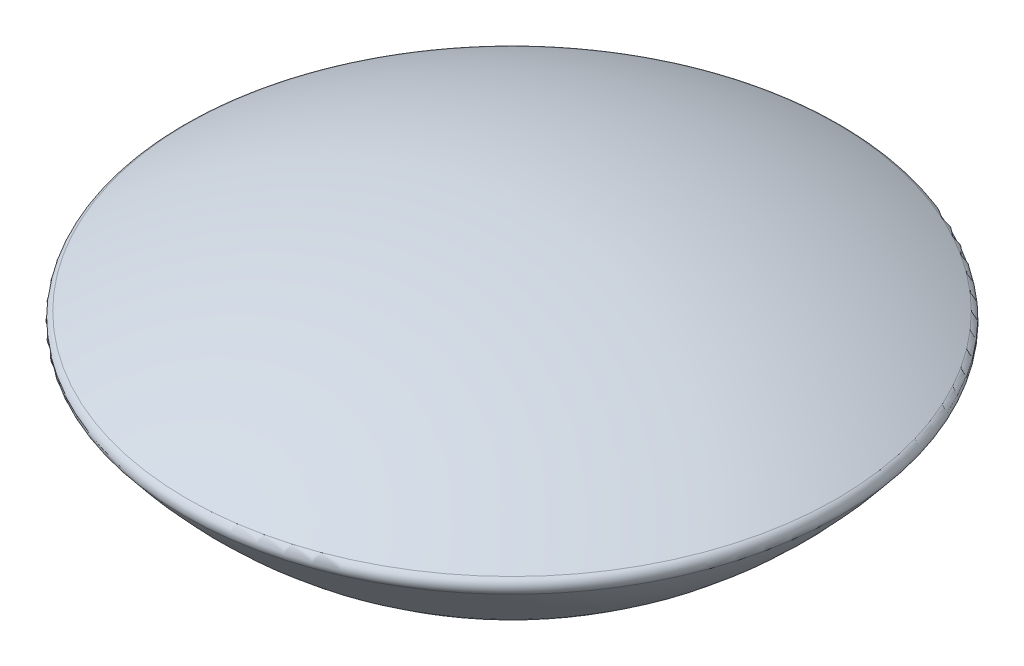
from build123d import *


with BuildPart() as part:
    # Sketch6 → lens (revolve)
    with BuildSketch(Plane.XY):
        with BuildLine():
            ThreePointArc((0, 0.38), (2.643822882, 0.993888177), (4.746641894, 2.709933144))
            ThreePointArc((4.746641894, 2.709933144), (4.77088424, 2.816637307), (4.704997748, 2.904001144))
            ThreePointArc((4.704997748, 2.904001144), (2.424869951, 3.781546563), (0, 4.08))
            Line((0, 4.08), (0, 0.38))
        make_face()
    revolve(axis=Axis((0, 7.032964905, 0), (0, -1, 0)))


solid = part.part
